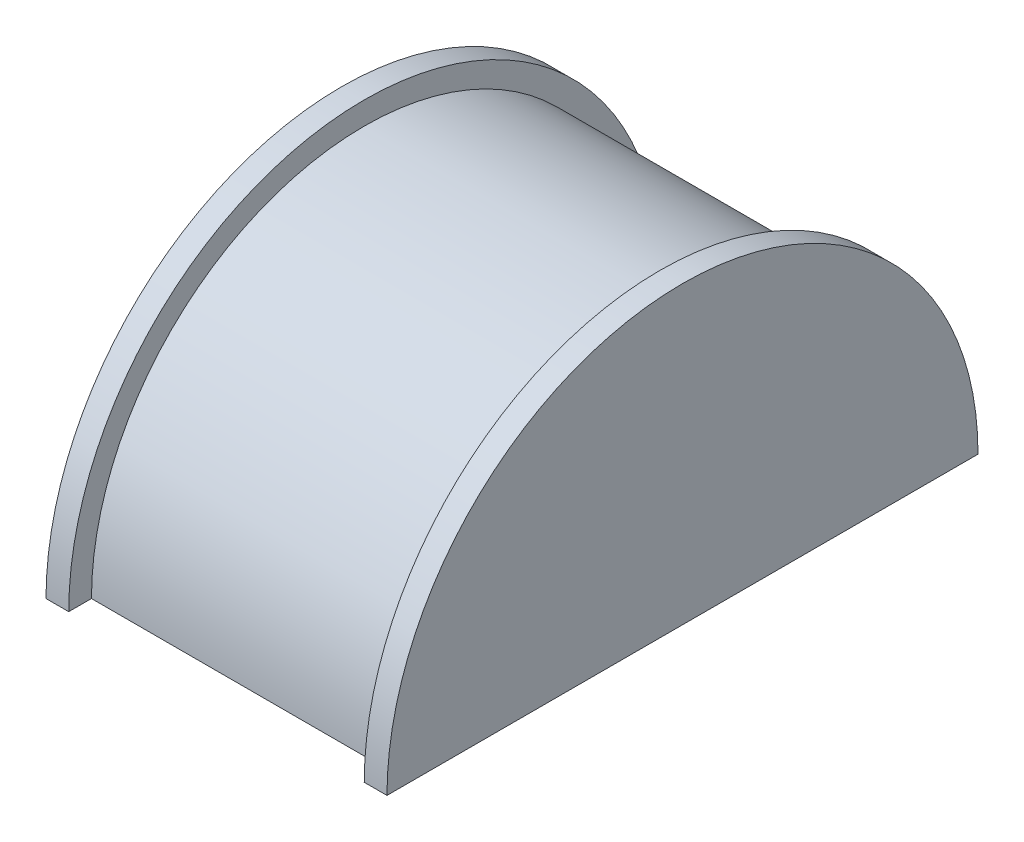
from build123d import *

# Parameters (mm, degrees)
BOSS_EXTRUDE1_DEPTH = 6.5
BOSS_EXTRUDE2_DEPTH = 0.5
SKETCH4_R           = 1.9
CUT_EXTRUDE1_DEPTH  = 5


with BuildPart() as part:
    # Sketch2 → Boss-Extrude1 (new body)
    with BuildSketch(Plane(origin=(0, 0, 0), x_dir=(0, 0, -1), z_dir=(1, 0, 0))):
        with BuildLine():
            Line((-6, 0), (6, 0))
            ThreePointArc((6, 0), (0, 6), (-6, 0))
        make_face()
    extrude(amount=BOSS_EXTRUDE1_DEPTH)

    # Sketch3 → Boss-Extrude2 (add)
    with BuildSketch(Plane(origin=(6.5, 0, 0), x_dir=(0, 0, -1), z_dir=(1, 0, 0))):
        with BuildLine():
            Line((-6.5, 0), (6.5, 0))
            ThreePointArc((6.5, 0), (0, 6.5), (-6.5, 0))
        make_face()
    boss_extrude2 = extrude(amount=BOSS_EXTRUDE2_DEPTH)

    # Mirror1: Boss-Extrude2 across plane
    add(boss_extrude2.mirror(Plane(origin=(3.25, 0, 0), x_dir=(0, 0, 1), z_dir=(1, 0, 0))))

    # Sketch4 → Cut-Extrude1 (cut)
    with BuildSketch(Plane.XZ):
        with Locations(Location((3.25, 0, 0), (0, 0, 270))):
            Circle(SKETCH4_R)
    extrude(amount=-CUT_EXTRUDE1_DEPTH, mode=Mode.SUBTRACT)


solid = part.part
